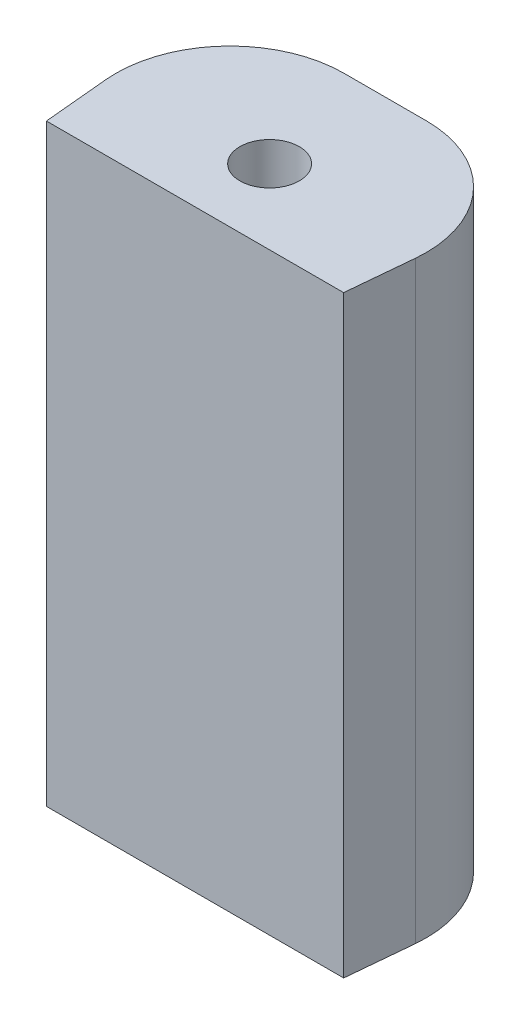
from build123d import *

# Parameters (mm, degrees)
SKETCH1_R               = 1.984375
BOSS_EXTRUDE1_DEPTH     = 169.87265999999997
CUT_EXTRUDE1_DEPTH      = 23.05812
CUT_EXTRUDE2_START      = -169.87266
CUT_EXTRUDE2_DEPTH      = 23.05812
FILLET1_R               = 7.62
CUT_EXTRUDE3_DEPTH      = 198.3909425992125
CUT_EXTRUDE3_DEPTH_BACK = 198.3909425992125
SKETCH6_R               = 2.100000000000005
SKETCH6_R_2             = 2.0999999999999983
CUT_EXTRUDE4_DEPTH      = 198.3909425992125
CUT_EXTRUDE4_DEPTH_BACK = 198.3909425992125
SKETCH7_W               = 96.26632678346117
SKETCH7_H               = 79.91099312056471
SKETCH7_H_2             = 50.31480687943524
CUT_EXTRUDE5_DEPTH      = 109.06635501646407
CUT_EXTRUDE5_DEPTH_BACK = 109.06635501646407


with BuildPart() as part:
    # Sketch1 → Boss-Extrude1 (new body)
    with BuildSketch(Plane(origin=(0, 0, 0), x_dir=(1, 0, 0), z_dir=(0, 1, 0))):
        with BuildLine():
            Line((-9.955287346489113, -3.6074515728352274), (-6.769721367669625, -3.607451572835229))
            Line((-6.769721367669625, -3.607451572835229), (8.985913588520251, -3.607451572835254))
            Line((8.985913588520251, -3.607451572835254), (12.171479567676489, -3.6074515728352536))
            add(Edge.make_bspline(
                [(10.60289964969583, -20.752451572835255), (11.099968974105767, -15.73020157118813), (11.63056361676113, -10.016003165571346), (12.11399787104698, -4.2968169522780775), (12.171479567676489, -3.6074515728352536)],
                knots=[0.38496962590391054, 0.38496962590391054, 0.38496962590391054, 0.38496962590391054, 0.4581086713676085, 0.468131593311824, 0.468131593311824, 0.468131593311824, 0.468131593311824], degree=3))
            add(Edge.make_bspline(
                [(1.1080961105936413, -99.87377835629641), (4.527344743513008, -73.5317641629186), (7.98655990047842, -47.187219651543), (10.60289964969583, -20.752451572835255)],
                knots=[0, 0, 0, 0, 0.38496962590391054, 0.38496962590391054, 0.38496962590391054, 0.38496962590391054], degree=3))
            add(Edge.make_bspline(
                [(1.1080961105936413, -99.87377835629641), (-2.311152522316452, -73.53176416292023), (-5.77036767929202, -47.18721965154205), (-8.386707428509173, -20.752451572835213)],
                knots=[0, 0, 0, 0, 0.3849696259039116, 0.3849696259039116, 0.3849696259039116, 0.3849696259039116], degree=3))
            add(Edge.make_bspline(
                [(-8.386707428509173, -20.752451572835213), (-8.88377675291906, -15.730201571188243), (-9.414371395575625, -10.016003165551679), (-9.897805649859514, -4.29681695227938), (-9.955287346489113, -3.6074515728352274)],
                knots=[0.3849696259039116, 0.3849696259039116, 0.3849696259039116, 0.3849696259039116, 0.4581086713676079, 0.46813159331185, 0.46813159331185, 0.46813159331185, 0.46813159331185], degree=3))
        make_face()
        with Locations(Location((1.10810856874065, -11.326456678177, 0), (0, 0, 270))):
            Circle(SKETCH1_R, mode=Mode.SUBTRACT)
    extrude(amount=BOSS_EXTRUDE1_DEPTH)

    # Sketch2 → Cut-Extrude1 (cut)
    with BuildSketch(Plane(origin=(0, 169.87265999999997, 0), x_dir=(1, 0, 0), z_dir=(0, 1, 0))):
        Polygon((-9.955287346489113, -3.6074515728352274), (25.808519749497883, -3.6074515728352274), (25.808519749497883, -26.312456678177), (-9.95528734648911, -26.312456678177), align=None)
    extrude(amount=-CUT_EXTRUDE1_DEPTH, mode=Mode.SUBTRACT)

    # Sketch2<2> → Cut-Extrude2 (cut)
    with BuildSketch(Plane(origin=(0, 169.87265999999997, 0), x_dir=(1, 0, 0), z_dir=(0, 1, 0)).offset(CUT_EXTRUDE2_START)):
        Polygon((-9.955287346489113, -3.6074515728352274), (25.808519749497883, -3.6074515728352274), (25.808519749497883, -26.312456678177), (-9.95528734648911, -26.312456678177), align=None)
    extrude(amount=CUT_EXTRUDE2_DEPTH, mode=Mode.SUBTRACT)

    # Fillet1
    fillet1_edges = [part.edges().sort_by_distance(p)[0] for p in [
        (-7.8241553741226255, 11.529059999999971, 26.312456678177),
        (10.04034759530939, 11.529059999999971, 26.312456678177),
        (-9.955287346489113, 84.93632999999997, 3.6074515728352274),
        (12.171479567676489, 84.93632999999997, 3.6074515728352536),
        (-7.8241553741226255, 158.34359999999998, 26.312456678177),
        (10.04034759530939, 158.34359999999998, 26.312456678177),
    ]]
    fillet(fillet1_edges, radius=FILLET1_R)

    # Sketch6 → Cut-Extrude3 (cut, two sides: drawn at the far end of the back side and taken through both)
    with BuildSketch(Plane.XZ.offset(-CUT_EXTRUDE3_DEPTH_BACK)):
        with Locations(Location((1.1080961105936413, 71.9337783562964, 0), (0, 0, 270))):
            Circle(SKETCH6_R)
        with Locations(Location((1.1080961105935272, 34.76055213743882, 0), (0, 0, 270))):
            Circle(SKETCH6_R_2)
    extrude(amount=CUT_EXTRUDE3_DEPTH + CUT_EXTRUDE3_DEPTH_BACK, mode=Mode.SUBTRACT)

    # Sketch7 → Cut-Extrude4 (cut, two sides: drawn at the far end of the back side and taken through both)
    with BuildSketch(Plane(origin=(0, 0, 0), x_dir=(0, 0, -1), z_dir=(1, 0, 0)).offset(-CUT_EXTRUDE4_DEPTH_BACK)):
        with Locations((-51.740614964565815, 39.955496560282356)):
            Rectangle(SKETCH7_W, SKETCH7_H)
        with Locations((-51.740614964565815, 144.71525656028234)):
            Rectangle(SKETCH7_W, SKETCH7_H_2)
    extrude(amount=CUT_EXTRUDE4_DEPTH + CUT_EXTRUDE4_DEPTH_BACK, mode=Mode.SUBTRACT)

    # Sketch8 → Cut-Extrude5 (cut, two sides: drawn at the far end of the back side and taken through both)
    with BuildSketch(Plane.XZ.offset(-79.91099312056471).offset(-CUT_EXTRUDE5_DEPTH_BACK)):
        Polygon((-35.738182727497644, 136.6065064389988), (32.4461710118659, 136.6065064389988), (32.446171011865914, 16.307451572835227), (-35.73818272749763, 16.307451572835227), align=None)
    extrude(amount=CUT_EXTRUDE5_DEPTH + CUT_EXTRUDE5_DEPTH_BACK, mode=Mode.SUBTRACT)


solid = part.part
